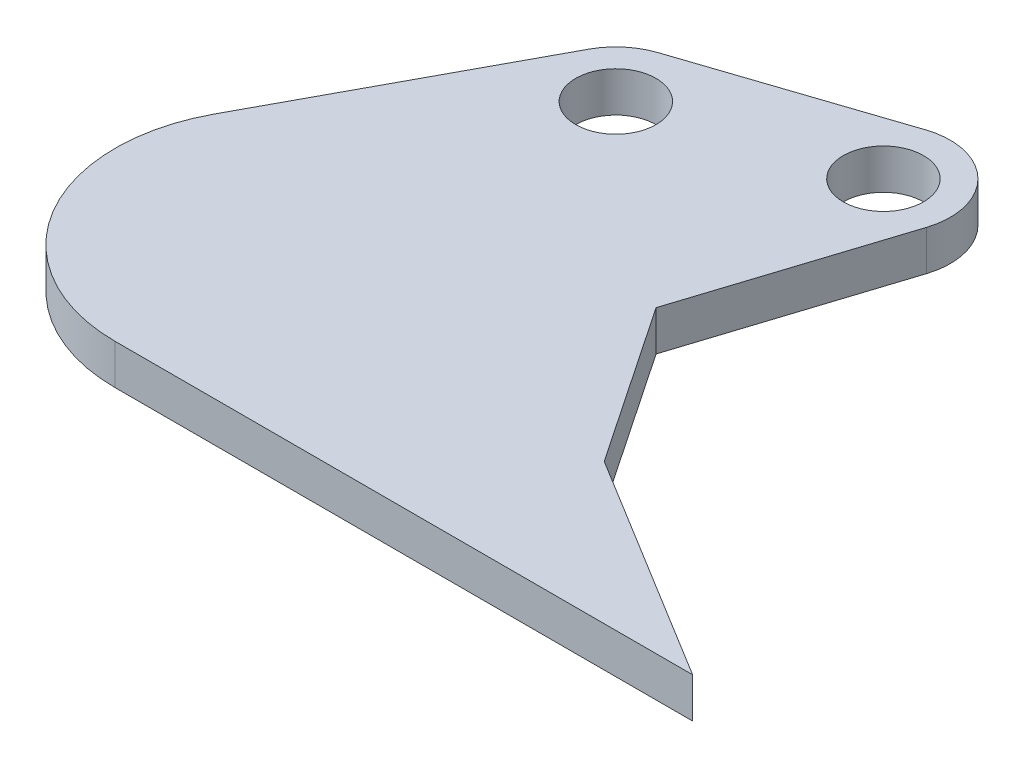
from build123d import *

# Parameters (mm, degrees)
SKETCH_2_R      = 12.5
SKETCH_2_R_2    = 5
SKETCH_2_R_3    = 3
EXTRUDE_1_DEPTH = 3


with BuildPart() as part:
    # 草图2 → 凸台-拉伸1 (new body)
    # profile 1 of 4: a face of its own
    with BuildSketch(Plane(origin=(0, 0, 0), x_dir=(1, 0, 0), z_dir=(0, 1, 0))):
        with BuildLine():
            Line((7.863659035, -28.733376736), (-0.149942941, -16.843591901))
            Line((-0.149942941, -16.843591901), (4.761239815, -1.526628777))
            ThreePointArc((4.761239815, -1.526628777), (-3.515199494, -3.555752033), (-1.58113883, 4.74341649))
            Line((-1.58113883, 4.74341649), (-16.58113883, -0.25658351))
            ThreePointArc((-16.58113883, -0.25658351), (-12.076448577, -0.943789074), (-10, -5))
            ThreePointArc((-10, -5), (-16.222270381, -9.848304355), (-19.402422046, -2.629624476))
            Line((-19.402422046, -2.629624476), (-29.193931666, -20.815079176))
            ThreePointArc((-29.193931666, -20.815079176), (-15.132200589, -14.620257894), (-5.687876925, -26.741018684))
            ThreePointArc((-5.687876925, -26.741018684), (-9.34904216, -35.579853449), (-18.187876925, -39.241018684))
            Line((-18.187876925, -39.241018684), (24.980566617, -39.241018684))
            Line((24.980566617, -39.241018684), (7.863659035, -28.733376736))
        make_face()
    # profile 2 of 4: a face of its own
    with BuildSketch(Plane(origin=(0, 0, 0), x_dir=(1, 0, 0), z_dir=(0, 1, 0))):
        with Locations((-18.187876925, -26.741018684)):
            Circle(SKETCH_2_R)
    # profile 3 of 4: a face of its own
    with BuildSketch(Plane(origin=(0, 0, 0), x_dir=(1, 0, 0), z_dir=(0, 1, 0))):
        with Locations((-15, -5)):
            Circle(SKETCH_2_R_2)
        with Locations(Location((-15, -5, 0), (0, 0, 270))):
            Circle(SKETCH_2_R_3, mode=Mode.SUBTRACT)
    # profile 4 of 4: a face of its own
    with BuildSketch(Plane(origin=(0, 0, 0), x_dir=(1, 0, 0), z_dir=(0, 1, 0))):
        Circle(SKETCH_2_R_2)
        with Locations(Location((0, 0, 0), (0, 0, 270))):
            Circle(SKETCH_2_R_3, mode=Mode.SUBTRACT)
    extrude(amount=EXTRUDE_1_DEPTH)


solid = part.part
